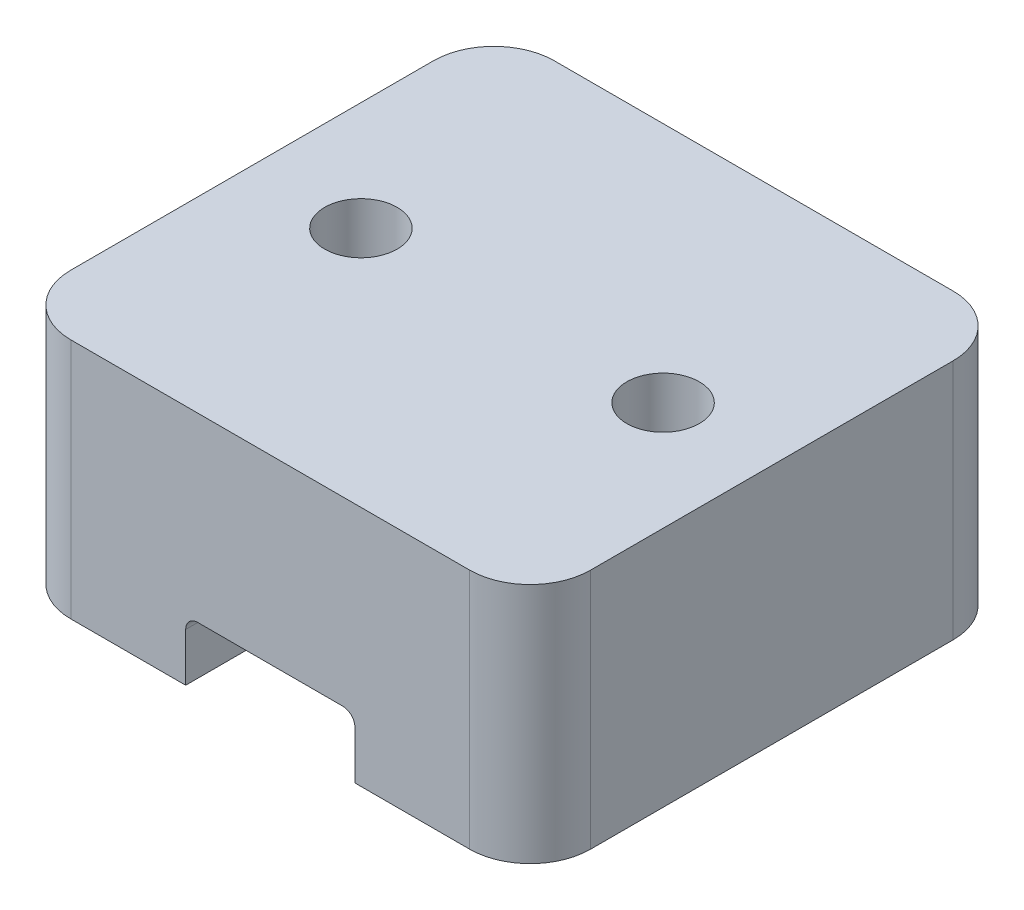
from build123d import *

# Parameters (mm, degrees)
SKETCH1_W           = 43
SKETCH1_H           = 40
BOSS_EXTRUDE1_DEPTH = 20
CUT_EXTRUDE1_REACH  = 64.04
SKETCH2_R           = 3
FILLET1_R           = 5
CUT_EXTRUDE2_REACH  = 64.04
SKETCH3_W           = 14
SKETCH3_H           = 5
FILLET2_R           = 1


with BuildPart() as part:
    # Sketch1 → Boss-Extrude1 (new body)
    with BuildSketch(Plane(origin=(0, 0, 0), x_dir=(1, 0, 0), z_dir=(0, 1, 0))):
        with Locations((21.5, 20)):
            Rectangle(SKETCH1_W, SKETCH1_H)
    extrude(amount=BOSS_EXTRUDE1_DEPTH)

    # Sketch2 → Cut-Extrude1 (cut, up to next)
    with BuildSketch(Plane(origin=(0, 20, 0), x_dir=(1, 0, 0), z_dir=(0, 1, 0)), mode=Mode.PRIVATE) as cut_extrude1_sk1:
        with Locations(Location((9, 20, 0), (0, 0, 270))):
            Circle(SKETCH2_R)
    cut_extrude1_tool1 = extrude(cut_extrude1_sk1.sketch, amount=-CUT_EXTRUDE1_REACH, mode=Mode.PRIVATE) & part.part
    # Sketch2 → Cut-Extrude1 (cut, up to next)
    with BuildSketch(Plane(origin=(0, 20, 0), x_dir=(1, 0, 0), z_dir=(0, 1, 0)), mode=Mode.PRIVATE) as cut_extrude1_sk2:
        with Locations(Location((34, 20, 0), (0, 0, 270))):
            Circle(SKETCH2_R)
    cut_extrude1_tool2 = extrude(cut_extrude1_sk2.sketch, amount=-CUT_EXTRUDE1_REACH, mode=Mode.PRIVATE) & part.part
    add(cut_extrude1_tool1.solids().sort_by_distance((9, 20, -20))[0], mode=Mode.SUBTRACT)
    add(cut_extrude1_tool2.solids().sort_by_distance((34, 20, -20))[0], mode=Mode.SUBTRACT)

    # Fillet1
    fillet1_edges = [part.edges().sort_by_distance(p)[0] for p in [
        (0, 10, -40),
        (43, 10, -40),
        (43, 10, 0),
        (0, 10, 0),
    ]]
    fillet(fillet1_edges, radius=FILLET1_R)

    # Sketch3 → Cut-Extrude2 (cut, up to next)
    with BuildSketch(Plane.XY, mode=Mode.PRIVATE) as cut_extrude2_sk1:
        with Locations((21.5, 2.5)):
            Rectangle(SKETCH3_W, SKETCH3_H)
    cut_extrude2_tool1 = extrude(cut_extrude2_sk1.sketch, amount=-CUT_EXTRUDE2_REACH, mode=Mode.PRIVATE) & part.part
    add(cut_extrude2_tool1.solids().sort_by_distance((21.5, 2.5, 0))[0], mode=Mode.SUBTRACT)

    # Fillet2
    fillet2_edges = [part.edges().sort_by_distance(p)[0] for p in [
        (14.5, 5, -20),
        (28.5, 5, -20),
    ]]
    fillet(fillet2_edges, radius=FILLET2_R)


solid = part.part
